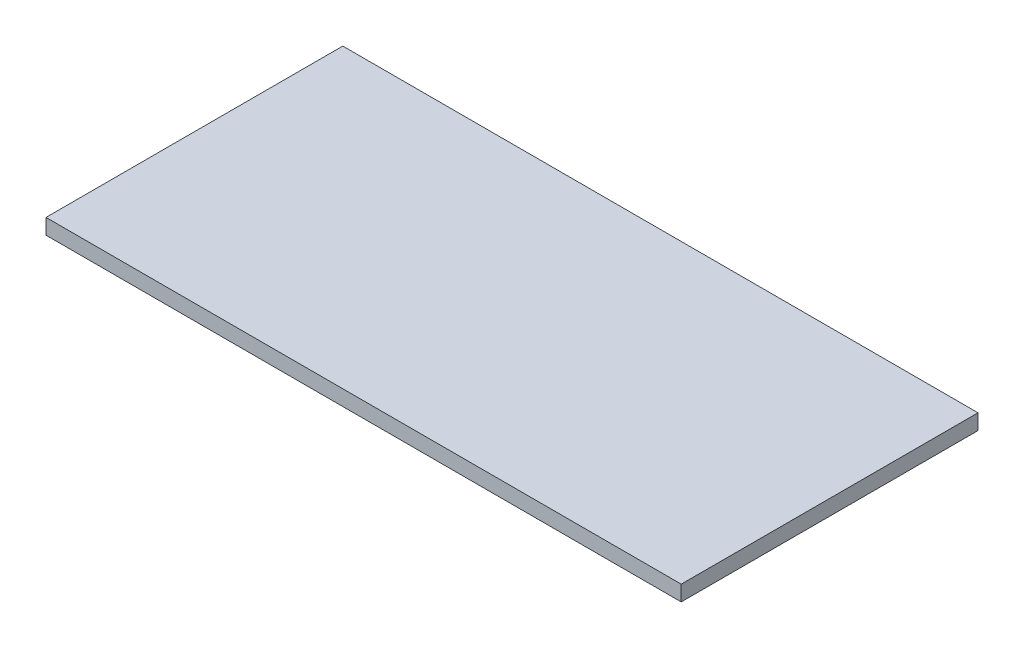
from build123d import *

# Parameters (mm, degrees)
SKETCH1_W           = 41.2
SKETCH1_H           = 19.25
BOSS_EXTRUDE1_DEPTH = 1


with BuildPart() as part:
    # Sketch1 → Boss-Extrude1 (new body)
    with BuildSketch(Plane(origin=(0, 0, 0), x_dir=(1, 0, 0), z_dir=(0, 1, 0))):
        Rectangle(SKETCH1_W, SKETCH1_H)
    extrude(amount=BOSS_EXTRUDE1_DEPTH)


solid = part.part
